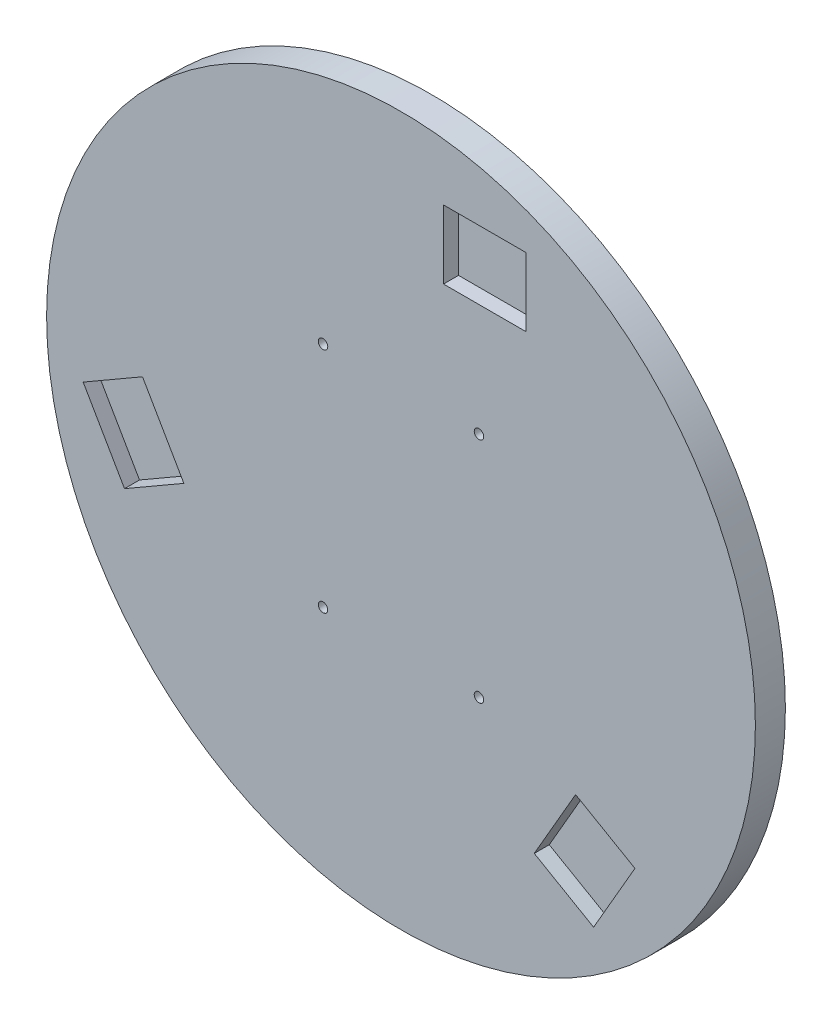
from build123d import *

# Parameters (mm, degrees)
ESQUISSE1_R             = 150
BOSS_EXTRU_1_DEPTH      = 12.7
ESQUISSE2_R             = 2
ENL_V_MAT_EXTRU_1_DEPTH = 12.7
ESQUISSE6_W             = 35
ESQUISSE6_H             = 29
ENL_V_MAT_EXTRU_2_DEPTH = 6.35


with BuildPart() as part:
    # Esquisse1 → Boss.-Extru.1 (new body)
    with BuildSketch(Plane.XY):
        Circle(ESQUISSE1_R)
    extrude(amount=BOSS_EXTRU_1_DEPTH)

    # Esquisse2 → Enlèv. mat.-Extru.1 (cut)
    with BuildSketch(Plane.XY.offset(12.7)):
        with Locations((-33, 48.25)):
            Circle(ESQUISSE2_R)
        with Locations((33, 48.25)):
            Circle(ESQUISSE2_R)
        with Locations((-33, -48.25)):
            Circle(ESQUISSE2_R)
        with Locations((33, -48.25)):
            Circle(ESQUISSE2_R)
    extrude(amount=-ENL_V_MAT_EXTRU_1_DEPTH, mode=Mode.SUBTRACT)

    # Esquisse6 → Enlèv. mat.-Extru.2 (cut)
    with BuildSketch(Plane.XY.offset(12.7)):
        with Locations((35.5, 110.228215567)):
            Rectangle(ESQUISSE6_W, ESQUISSE6_H)
        Polygon((73.90306654, -63.452565052), (56.40306654, -93.763454184), (81.51780325, -108.263454184), (99.01780325, -77.952565052), align=None)
        Polygon((-109.40306654, -1.964761383), (-91.90306654, -32.275650515), (-117.01780325, -46.775650515), (-134.51780325, -16.464761383), align=None)
    extrude(amount=-ENL_V_MAT_EXTRU_2_DEPTH, mode=Mode.SUBTRACT)


solid = part.part
